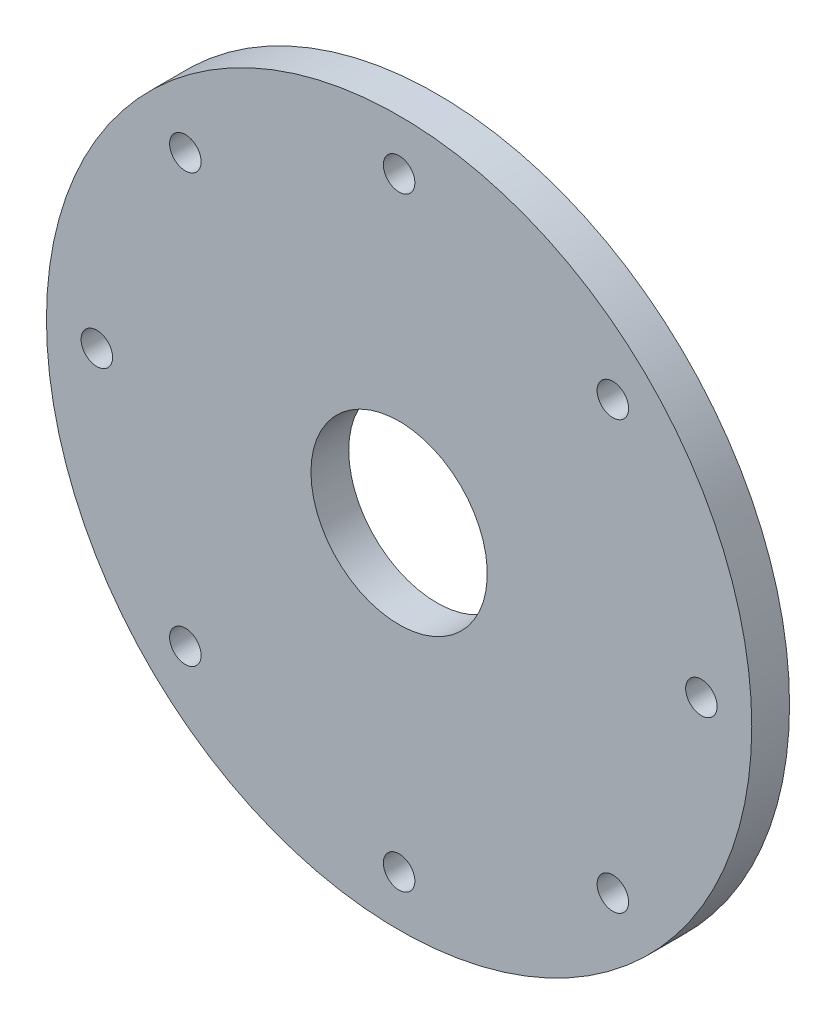
from build123d import *

# Parameters (mm, degrees)
SKETCH1_R           = 22.225
SKETCH1_R_2         = 0.9921875
SKETCH1_R_3         = 5.55625
BOSS_EXTRUDE1_DEPTH = 2.38125


with BuildPart() as part:
    # Sketch1 → Boss-Extrude1 (new body)
    with BuildSketch(Plane.XY):
        with Locations(Location((0, 0, 0), (0, 0, 180))):
            Circle(SKETCH1_R)
        with Locations(Location((-19.05, 0, 0), (0, 0, 180))):
            Circle(SKETCH1_R_2, mode=Mode.SUBTRACT)
        with Locations(Location((-13.470384182, 13.470384182, 0), (0, 0, 180))):
            Circle(SKETCH1_R_2, mode=Mode.SUBTRACT)
        with Locations(Location((0, 19.05, 0), (0, 0, 180))):
            Circle(SKETCH1_R_2, mode=Mode.SUBTRACT)
        with Locations(Location((13.470384182, 13.470384182, 0), (0, 0, 180))):
            Circle(SKETCH1_R_2, mode=Mode.SUBTRACT)
        with Locations(Location((19.05, 0, 0), (0, 0, 180))):
            Circle(SKETCH1_R_2, mode=Mode.SUBTRACT)
        with Locations(Location((13.470384182, -13.470384182, 0), (0, 0, 180))):
            Circle(SKETCH1_R_2, mode=Mode.SUBTRACT)
        with Locations(Location((0, -19.05, 0), (0, 0, 180))):
            Circle(SKETCH1_R_2, mode=Mode.SUBTRACT)
        with Locations(Location((-13.470384182, -13.470384182, 0), (0, 0, 180))):
            Circle(SKETCH1_R_2, mode=Mode.SUBTRACT)
        with Locations(Location((0, 0, 0), (0, 0, 180))):
            Circle(SKETCH1_R_3, mode=Mode.SUBTRACT)
    extrude(amount=BOSS_EXTRUDE1_DEPTH)


solid = part.part
